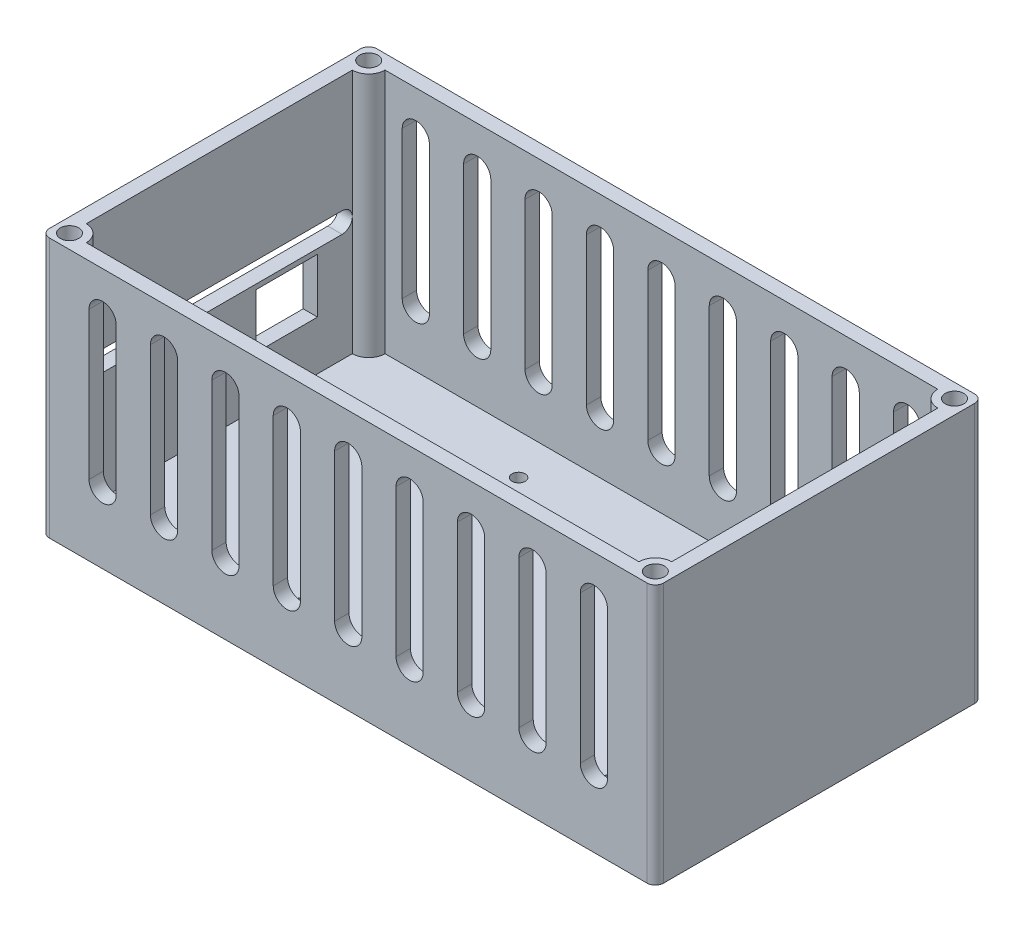
from build123d import *

# Parameters (mm, degrees)
SKETCH1_R           = 1.6
BOSS_EXTRUDE1_DEPTH = 3.5
SKETCH2_W           = 143
SKETCH2_H           = 73
BOSS_EXTRUDE2_DEPTH = 60
CUT_EXTRUDE1_DEPTH  = 127.71720483
CUT_EXTRUDE2_REACH  = 169.727
SKETCH5_W           = 15
SKETCH5_H           = 13.306266554
SKETCH6_R           = 2.25
CUT_EXTRUDE3_DEPTH  = 20


with BuildPart() as part:
    # Sketch1 → Boss-Extrude1 (new body)
    with BuildSketch(Plane(origin=(0, 0, 0), x_dir=(1, 0, 0), z_dir=(0, 1, 0))):
        with BuildLine():
            Line((-73, -40), (73, -40))
            ThreePointArc((73, -40), (74.414213562, -39.414213562), (75, -38))
            Line((75, -38), (75, 38))
            ThreePointArc((75, 38), (74.414213562, 39.414213562), (73, 40))
            Line((73, 40), (-73, 40))
            ThreePointArc((-73, 40), (-74.414213562, 39.414213562), (-75, 38))
            Line((-75, 38), (-75, -38))
            ThreePointArc((-75, -38), (-74.414213562, -39.414213562), (-73, -40))
        make_face()
        with Locations(Location((-25, 26.605, 0), (0, 0, 270))):
            Circle(SKETCH1_R, mode=Mode.SUBTRACT)
        with Locations(Location((49.93, 26.605, 0), (0, 0, 270))):
            Circle(SKETCH1_R, mode=Mode.SUBTRACT)
        with Locations(Location((49.93, -26.605, 0), (0, 0, 270))):
            Circle(SKETCH1_R, mode=Mode.SUBTRACT)
        with Locations(Location((-25, -26.605, 0), (0, 0, 270))):
            Circle(SKETCH1_R, mode=Mode.SUBTRACT)
        with Locations(Location((-45, 0, 0), (0, 0, 270))):
            Circle(SKETCH1_R, mode=Mode.SUBTRACT)
        with Locations(Location((35, 0, 0), (0, 0, 270))):
            Circle(SKETCH1_R, mode=Mode.SUBTRACT)
    extrude(amount=BOSS_EXTRUDE1_DEPTH)

    # Sketch2 → Boss-Extrude2 (add)
    # profile 1 of 5: a face of its own
    with BuildSketch(Plane(origin=(0, 3.5, 0), x_dir=(1, 0, 0), z_dir=(0, 1, 0))):
        with BuildLine():
            Line((73, 40), (-73, 40))
            ThreePointArc((-73, 40), (-74.414213562, 39.414213562), (-75, 38))
            Line((-75, 38), (-75, -38))
            ThreePointArc((-75, -38), (-74.414213562, -39.414213562), (-73, -40))
            Line((-73, -40), (73, -40))
            ThreePointArc((73, -40), (74.414213562, -39.414213562), (75, -38))
            Line((75, -38), (75, 38))
            ThreePointArc((75, 38), (74.414213562, 39.414213562), (73, 40))
        make_face()
        Rectangle(SKETCH2_W, SKETCH2_H, mode=Mode.SUBTRACT)
    # profile 2 of 5: a face of its own
    with BuildSketch(Plane(origin=(0, 3.5, 0), x_dir=(1, 0, 0), z_dir=(0, 1, 0))):
        with BuildLine():
            Line((-67.5, 36.5), (-71.5, 36.5))
            Line((-71.5, 36.5), (-71.5, 32.5))
            ThreePointArc((-71.5, 32.5), (-68.671572875, 33.671572875), (-67.5, 36.5))
        make_face()
    # profile 3 of 5: a face of its own
    with BuildSketch(Plane(origin=(0, 3.5, 0), x_dir=(1, 0, 0), z_dir=(0, 1, 0))):
        with BuildLine():
            ThreePointArc((-67.5, -36.5), (-68.671572875, -33.671572875), (-71.5, -32.5))
            Line((-71.5, -32.5), (-71.5, -36.5))
            Line((-71.5, -36.5), (-67.5, -36.5))
        make_face()
    # profile 4 of 5: a face of its own
    with BuildSketch(Plane(origin=(0, 3.5, 0), x_dir=(1, 0, 0), z_dir=(0, 1, 0))):
        with BuildLine():
            Line((71.5, 36.5), (67.5, 36.5))
            ThreePointArc((67.5, 36.5), (68.671572875, 33.671572875), (71.5, 32.5))
            Line((71.5, 32.5), (71.5, 36.5))
        make_face()
    # profile 5 of 5: a face of its own
    with BuildSketch(Plane(origin=(0, 3.5, 0), x_dir=(1, 0, 0), z_dir=(0, 1, 0))):
        with BuildLine():
            ThreePointArc((71.5, -32.5), (68.671572875, -33.671572875), (67.5, -36.5))
            Line((67.5, -36.5), (71.5, -36.5))
            Line((71.5, -36.5), (71.5, -32.5))
        make_face()
    extrude(amount=BOSS_EXTRUDE2_DEPTH)

    # Sketch3 → Cut-Extrude1 (cut, through all)
    with BuildSketch(Plane.XY.offset(40)):
        with BuildLine():
            Line((63.32083214, 17.25), (63.32083214, 53.25))
            ThreePointArc((63.32083214, 53.25), (60, 56.57083214), (56.67916786, 53.25))
            Line((56.67916786, 53.25), (56.67916786, 17.25))
            ThreePointArc((56.67916786, 17.25), (60, 13.92916786), (63.32083214, 17.25))
        make_face()
        with BuildLine():
            Line((48.32083214, 17.25), (48.32083214, 53.25))
            ThreePointArc((48.32083214, 53.25), (45, 56.57083214), (41.67916786, 53.25))
            Line((41.67916786, 53.25), (41.67916786, 17.25))
            ThreePointArc((41.67916786, 17.25), (45, 13.92916786), (48.32083214, 17.25))
        make_face()
        with BuildLine():
            Line((33.32083214, 17.25), (33.32083214, 53.25))
            ThreePointArc((33.32083214, 53.25), (30, 56.57083214), (26.67916786, 53.25))
            Line((26.67916786, 53.25), (26.67916786, 17.25))
            ThreePointArc((26.67916786, 17.25), (30, 13.92916786), (33.32083214, 17.25))
        make_face()
        with BuildLine():
            Line((18.32083214, 17.25), (18.32083214, 53.25))
            ThreePointArc((18.32083214, 53.25), (15, 56.57083214), (11.67916786, 53.25))
            Line((11.67916786, 53.25), (11.67916786, 17.25))
            ThreePointArc((11.67916786, 17.25), (15, 13.92916786), (18.32083214, 17.25))
        make_face()
        with BuildLine():
            Line((3.32083214, 17.25), (3.32083214, 53.25))
            ThreePointArc((3.32083214, 53.25), (0, 56.57083214), (-3.32083214, 53.25))
            Line((-3.32083214, 53.25), (-3.32083214, 17.25))
            ThreePointArc((-3.32083214, 17.25), (0, 13.92916786), (3.32083214, 17.25))
        make_face()
        with BuildLine():
            Line((-11.67916786, 17.25), (-11.67916786, 53.25))
            ThreePointArc((-11.67916786, 53.25), (-15, 56.57083214), (-18.32083214, 53.25))
            Line((-18.32083214, 53.25), (-18.32083214, 17.25))
            ThreePointArc((-18.32083214, 17.25), (-15, 13.92916786), (-11.67916786, 17.25))
        make_face()
        with BuildLine():
            Line((-26.67916786, 17.25), (-26.67916786, 53.25))
            ThreePointArc((-26.67916786, 53.25), (-30, 56.57083214), (-33.32083214, 53.25))
            Line((-33.32083214, 53.25), (-33.32083214, 17.25))
            ThreePointArc((-33.32083214, 17.25), (-30, 13.92916786), (-26.67916786, 17.25))
        make_face()
        with BuildLine():
            Line((-41.67916786, 17.25), (-41.67916786, 53.25))
            ThreePointArc((-41.67916786, 53.25), (-45, 56.57083214), (-48.32083214, 53.25))
            Line((-48.32083214, 53.25), (-48.32083214, 17.25))
            ThreePointArc((-48.32083214, 17.25), (-45, 13.92916786), (-41.67916786, 17.25))
        make_face()
        with BuildLine():
            Line((-56.67916786, 17.25), (-56.67916786, 53.25))
            ThreePointArc((-56.67916786, 53.25), (-60, 56.57083214), (-63.32083214, 53.25))
            Line((-63.32083214, 53.25), (-63.32083214, 17.25))
            ThreePointArc((-63.32083214, 17.25), (-60, 13.92916786), (-56.67916786, 17.25))
        make_face()
    extrude(amount=-CUT_EXTRUDE1_DEPTH, mode=Mode.SUBTRACT)

    # Sketch5 → Cut-Extrude2 (cut, up to next)
    with BuildSketch(Plane.ZY.offset(75), mode=Mode.PRIVATE) as cut_extrude2_sk1:
        with Locations((-16.5, 22.153133277)):
            Rectangle(SKETCH5_W, SKETCH5_H)
    cut_extrude2_tool1 = extrude(cut_extrude2_sk1.sketch, amount=-CUT_EXTRUDE2_REACH, mode=Mode.PRIVATE) & part.part
    # Sketch5 → Cut-Extrude2 (cut, up to next)
    with BuildSketch(Plane.ZY.offset(75), mode=Mode.PRIVATE) as cut_extrude2_sk2:
        with BuildLine():
            Line((30, 35), (-30, 35))
            ThreePointArc((-30, 35), (-32.5, 32.5), (-30, 30))
            Line((-30, 30), (30, 30))
            ThreePointArc((30, 30), (32.5, 32.5), (30, 35))
        make_face()
    cut_extrude2_tool2 = extrude(cut_extrude2_sk2.sketch, amount=-CUT_EXTRUDE2_REACH, mode=Mode.PRIVATE) & part.part
    add(cut_extrude2_tool1.solids().sort_by_distance((-75, 22.153133, -16.5))[0], mode=Mode.SUBTRACT)
    add(cut_extrude2_tool2.solids().sort_by_distance((-75, 32.5, 0))[0], mode=Mode.SUBTRACT)

    # Sketch6 → Cut-Extrude3 (cut)
    with BuildSketch(Plane(origin=(0, 63.5, 0), x_dir=(1, 0, 0), z_dir=(0, 1, 0))):
        with Locations(Location((-71.542893219, 36.542893219, 0), (0, 0, 270))):
            Circle(SKETCH6_R)
        with Locations(Location((71.542893219, 36.542893219, 0), (0, 0, 90))):
            Circle(SKETCH6_R)
        with Locations(Location((71.542893219, -36.542893219, 0), (0, 0, 270))):
            Circle(SKETCH6_R)
        with Locations(Location((-71.542893219, -36.542893219, 0), (0, 0, 90))):
            Circle(SKETCH6_R)
    extrude(amount=-CUT_EXTRUDE3_DEPTH, mode=Mode.SUBTRACT)


solid = part.part
